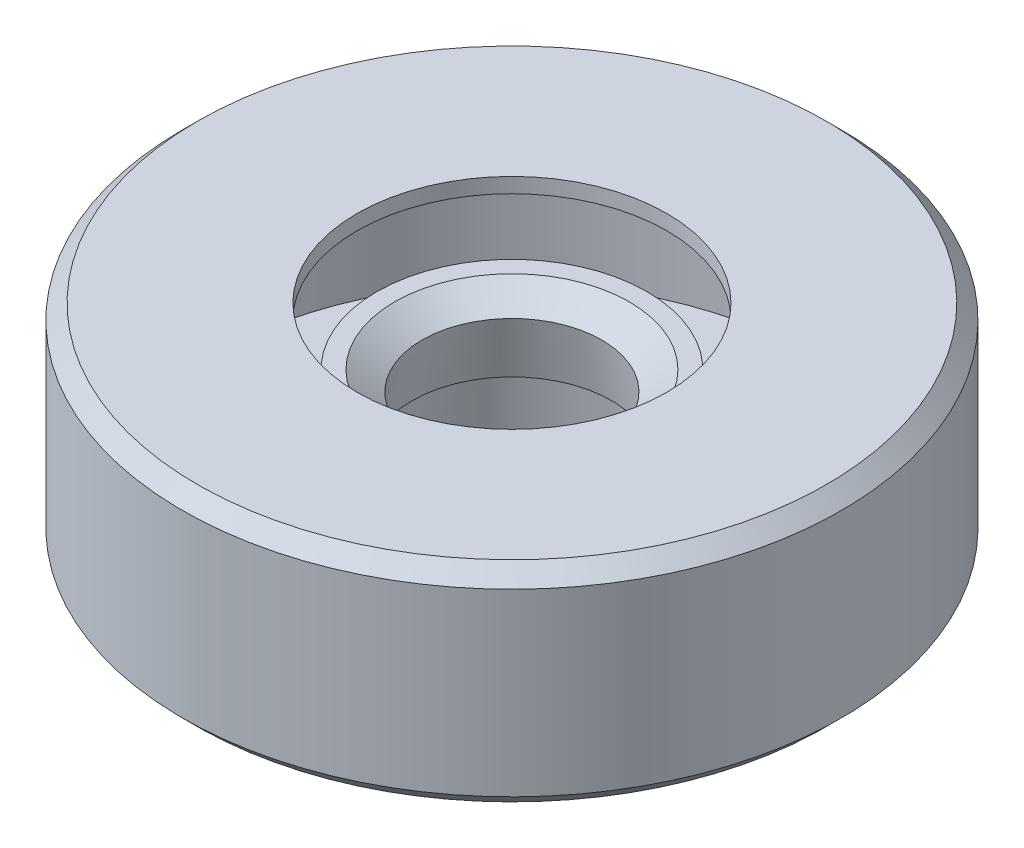
from build123d import *


with BuildPart() as part:
    # 草图1 → 旋转1 (revolve)
    with BuildSketch(Plane.XY):
        with BuildLine():
            Line((-10, 0.5), (-5.524030949, 0.5))
            Line((-5.524030949, 0.5), (-5.170477558, 1.112372436))
            Line((-5.170477558, 1.112372436), (-4.463370777, 1.112372436))
            Line((-4.463370777, 1.112372436), (-4.30697363, 2.9))
            ThreePointArc((-4.30697363, 2.9), (-4.74222381, 3.244464966), (-4.50697363, 3.747213595))
            Line((-4.50697363, 3.747213595), (-4.50697363, 5.071428571))
            Line((-4.50697363, 5.071428571), (-3.918095147, 5.071428571))
            Line((-3.918095147, 5.071428571), (-3, 4.428571429))
            Line((-3, 4.428571429), (-3.340059177, 2.5))
            Line((-3.340059177, 2.5), (-3.840059177, 2.5))
            Line((-3.840059177, 2.5), (-4.058780836, 0))
            Line((-4.058780836, 0), (-10.5, 0))
            Line((-10.5, 0), (-11, 0.5))
            Line((-11, 0.5), (-11, 6.5))
            Line((-11, 6.5), (-10.5, 7))
            Line((-10.5, 7), (-5.170477558, 7))
            Line((-5.170477558, 7), (-5.170477558, 6.5))
            Line((-5.170477558, 6.5), (-10, 6.5))
            Line((-10, 6.5), (-10, 0.5))
        make_face()
    revolve(axis=Axis((0, 5.836193369, 0), (0, -1, 0)))


solid = part.part
